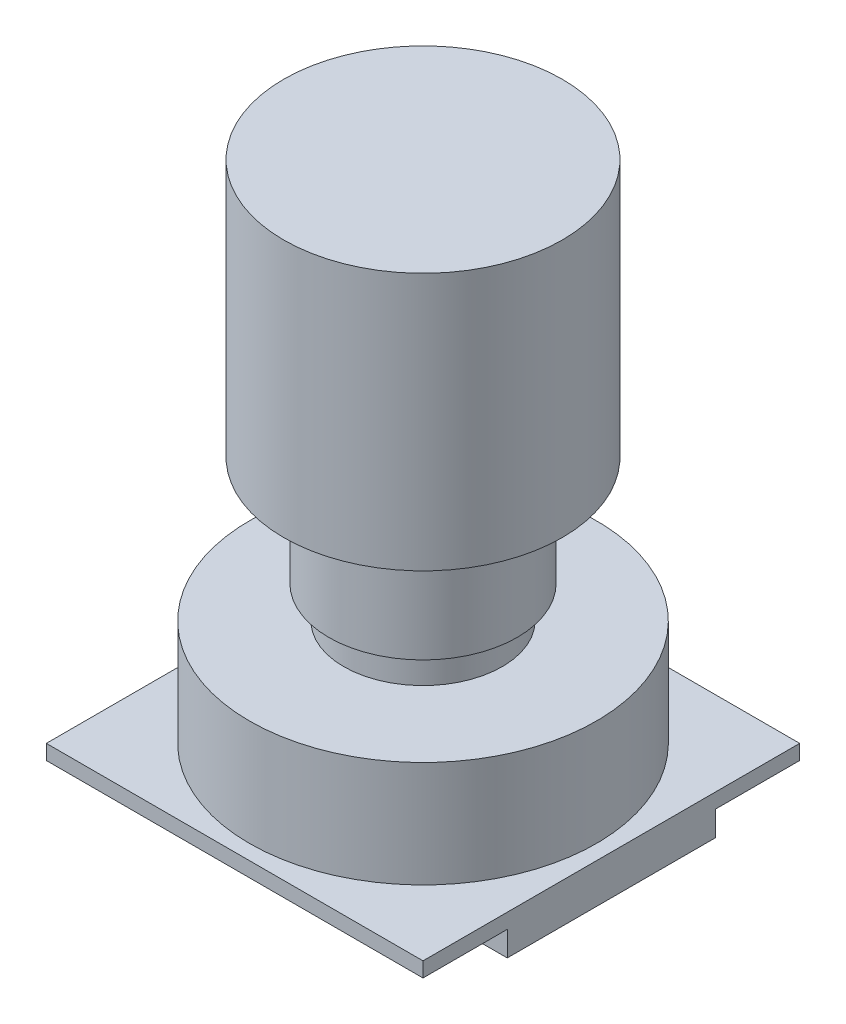
from build123d import *

# Parameters (mm, degrees)
SKETCH1_W           = 38
SKETCH1_H           = 38
BOSS_EXTRUDE1_DEPTH = 1.5
SKETCH2_R           = 17.5
BOSS_EXTRUDE2_DEPTH = 10.7
SKETCH3_R           = 8
BOSS_EXTRUDE3_DEPTH = 3.3
SKETCH4_R           = 9.5
BOSS_EXTRUDE4_DEPTH = 11
SKETCH5_R           = 14.05
BOSS_EXTRUDE5_DEPTH = 26
SKETCH7_W           = 6
SKETCH7_H           = 21
BOSS_EXTRUDE6_DEPTH = 2.5


with BuildPart() as part:
    # Sketch1 → Boss-Extrude1 (new body)
    with BuildSketch(Plane(origin=(0, 0, 0), x_dir=(1, 0, 0), z_dir=(0, 1, 0))):
        Rectangle(SKETCH1_W, SKETCH1_H)
    extrude(amount=BOSS_EXTRUDE1_DEPTH)

    # Sketch2 → Boss-Extrude2 (add)
    with BuildSketch(Plane(origin=(0, 1.5, 0), x_dir=(1, 0, 0), z_dir=(0, 1, 0))):
        with Locations(Location((0, 0, 0), (0, 0, 270))):
            Circle(SKETCH2_R)
    extrude(amount=BOSS_EXTRUDE2_DEPTH)

    # Sketch3 → Boss-Extrude3 (add)
    with BuildSketch(Plane(origin=(0, 12.2, 0), x_dir=(1, 0, 0), z_dir=(0, 1, 0))):
        with Locations(Location((0, 0, 0), (0, 0, 270))):
            Circle(SKETCH3_R)
    extrude(amount=BOSS_EXTRUDE3_DEPTH)

    # Sketch4 → Boss-Extrude4 (add)
    with BuildSketch(Plane(origin=(0, 15.5, 0), x_dir=(1, 0, 0), z_dir=(0, 1, 0))):
        with Locations(Location((0, 0, 0), (0, 0, 270))):
            Circle(SKETCH4_R)
    extrude(amount=BOSS_EXTRUDE4_DEPTH)

    # Sketch5 → Boss-Extrude5 (add)
    with BuildSketch(Plane(origin=(0, 26.5, 0), x_dir=(1, 0, 0), z_dir=(0, 1, 0))):
        with Locations(Location((0, 0, 0), (0, 0, 90))):
            Circle(SKETCH5_R)
    extrude(amount=BOSS_EXTRUDE5_DEPTH)

    # Sketch7 → Boss-Extrude6 (add)
    with BuildSketch(Plane.XZ):
        with Locations((16, 0)):
            Rectangle(SKETCH7_W, SKETCH7_H)
    extrude(amount=BOSS_EXTRUDE6_DEPTH)


solid = part.part
